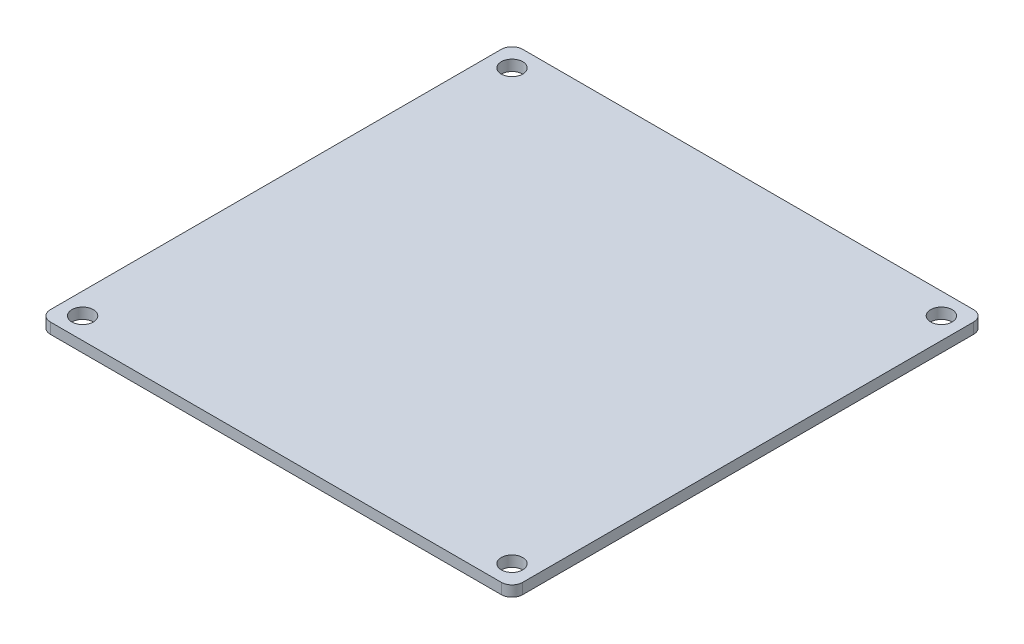
from build123d import *

# Parameters (mm, degrees)
SKETCH_1_R      = 1.5
EXTRUDE_1_DEPTH = 1.5


with BuildPart() as part:
    # Эскиз1 → Бобышка-Вытянуть1 (new body)
    with BuildSketch(Plane(origin=(0, 0, 0), x_dir=(1, 0, 0), z_dir=(0, 1, 0))):
        with BuildLine():
            Line((-31.5, 33), (31.5, 33))
            ThreePointArc((31.5, 33), (32.560660172, 32.560660172), (33, 31.5))
            Line((33, 31.5), (33, -31.5))
            ThreePointArc((33, -31.5), (32.560660172, -32.560660172), (31.5, -33))
            Line((31.5, -33), (-31.5, -33))
            ThreePointArc((-31.5, -33), (-32.560660172, -32.560660172), (-33, -31.5))
            Line((-33, -31.5), (-33, 31.5))
            ThreePointArc((-33, 31.5), (-32.560660172, 32.560660172), (-31.5, 33))
        make_face()
        with Locations(Location((-30, 30, 0), (0, 0, 270))):
            Circle(SKETCH_1_R, mode=Mode.SUBTRACT)
        with Locations(Location((30, 30, 0), (0, 0, 270))):
            Circle(SKETCH_1_R, mode=Mode.SUBTRACT)
        with Locations(Location((30, -30, 0), (0, 0, 270))):
            Circle(SKETCH_1_R, mode=Mode.SUBTRACT)
        with Locations(Location((-30, -30, 0), (0, 0, 270))):
            Circle(SKETCH_1_R, mode=Mode.SUBTRACT)
    extrude(amount=EXTRUDE_1_DEPTH)


solid = part.part
